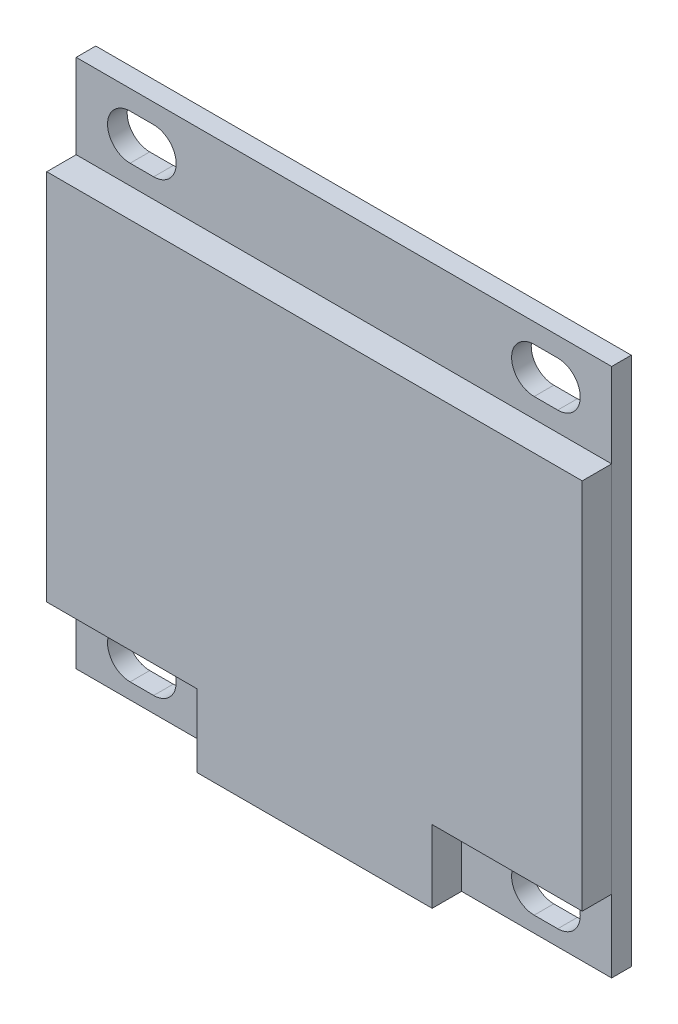
from build123d import *

# Parameters (mm, degrees)
SKETCH1_W           = 27.3
SKETCH1_H           = 27
BOSS_EXTRUDE1_DEPTH = 1
BOSS_EXTRUDE2_DEPTH = 1.5
CUT_EXTRUDE1_DEPTH  = 20.256752063


with BuildPart() as part:
    # Sketch1 → Boss-Extrude1 (new body)
    with BuildSketch(Plane.XY):
        Rectangle(SKETCH1_W, SKETCH1_H)
    extrude(amount=BOSS_EXTRUDE1_DEPTH)

    # Sketch3 → Cut-Extrude1 (cut, through all)
    with BuildSketch(Plane.XY.offset(1)):
        with BuildLine():
            Line((-10.9, 12.5), (-9.7, 12.5))
            ThreePointArc((-9.7, 12.5), (-8.55, 11.35), (-9.7, 10.2))
            Line((-9.7, 10.2), (-10.9, 10.2))
            ThreePointArc((-10.9, 10.2), (-12.05, 11.35), (-10.9, 12.5))
        make_face()
        with BuildLine():
            Line((10.9, 12.5), (9.7, 12.5))
            ThreePointArc((9.7, 12.5), (8.55, 11.35), (9.7, 10.2))
            Line((9.7, 10.2), (10.9, 10.2))
            ThreePointArc((10.9, 10.2), (12.05, 11.35), (10.9, 12.5))
        make_face()
        with BuildLine():
            Line((-10.9, -10.4), (-9.7, -10.4))
            ThreePointArc((-9.7, -10.4), (-8.55, -11.55), (-9.7, -12.7))
            Line((-9.7, -12.7), (-10.9, -12.7))
            ThreePointArc((-10.9, -12.7), (-12.05, -11.55), (-10.9, -10.4))
        make_face()
        with BuildLine():
            Line((10.9, -10.4), (9.7, -10.4))
            ThreePointArc((9.7, -10.4), (8.55, -11.55), (9.7, -12.7))
            Line((9.7, -12.7), (10.9, -12.7))
            ThreePointArc((10.9, -12.7), (12.05, -11.55), (10.9, -10.4))
        make_face()
    extrude(amount=-CUT_EXTRUDE1_DEPTH, mode=Mode.SUBTRACT)


with BuildPart() as body_2:
    # Sketch2 → Boss-Extrude2 (new body)
    with BuildSketch(Plane.XY.offset(1)):
        Polygon((-13.65, -9.8), (-6, -9.8), (-6, -13.5), (6, -13.5), (6, -9.8), (13.65, -9.8), (13.65, 9.2), (-13.65, 9.2), align=None)
    extrude(amount=BOSS_EXTRUDE2_DEPTH)


solid = Compound([part.part, body_2.part])
